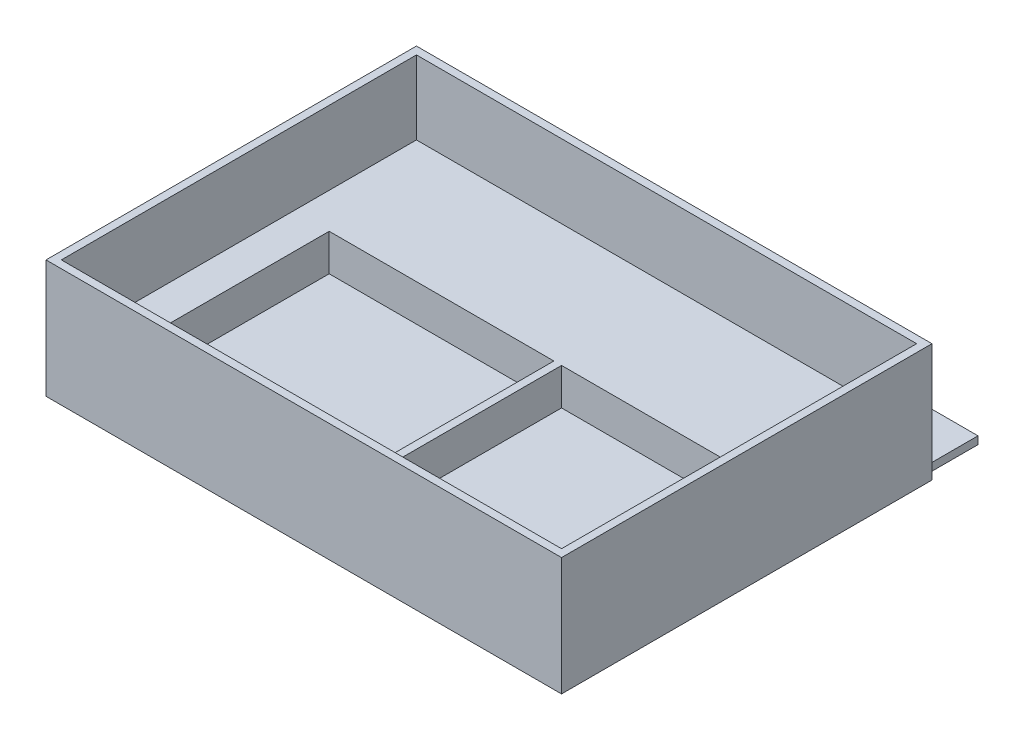
from build123d import *

# Parameters (mm, degrees)
SKETCH1_W            = 609.6
SKETCH1_H            = 304.8
SKETCH1_W_2          = 93
SKETCH1_H_2          = 93
BOSS_EXTRUDE1_DEPTH  = 15.24
SKETCH2_W            = 609.6
SKETCH2_H            = 304.8
BOSS_EXTRUDE2_DEPTH  = 3.175
SKETCH3_W            = 609.6
SKETCH3_H            = 304.8
SKETCH3_W_2          = 603.25
SKETCH3_H_2          = 254
BOSS_EXTRUDE3_DEPTH  = 30.48
SKETCH4_OUTSIDE_W    = 748.262
SKETCH4_OUTSIDE_H    = 443.462
SKETCH4_OUTSIDE_W_2  = 609.6
SKETCH4_OUTSIDE_H_2  = 260.35
CUT_EXTRUDE1_DEPTH   = 45.72
SKETCH5_R            = 3.4925
CUT_EXTRUDE2_DEPTH   = 344.830071983
SKETCH6_W            = 327.140785269
SKETCH6_H            = 256.091806272
TEMPORARY_CUT_DEPTH  = 430.914472374
SKETCH7_W            = 260.35
SKETCH7_H            = 48.895
TEMPORARY_SIDE_DEPTH = 3.175
SKETCH8_W            = 381.398207811
SKETCH8_H            = 265.653299783
CUT_EXTRUDE3_DEPTH   = 354.138073599
SKETCH9_W            = 213.3875
SKETCH9_H            = 48.895
BOSS_EXTRUDE4_DEPTH  = 3.175


with BuildPart() as part:
    # Sketch1 → Boss-Extrude1 (new body)
    with BuildSketch(Plane(origin=(0, 0, 0), x_dir=(1, 0, 0), z_dir=(0, 1, 0))):
        Rectangle(SKETCH1_W, SKETCH1_H)
        with Locations((-48.0875, 29.7)):
            Rectangle(SKETCH1_W_2, SKETCH1_H_2, mode=Mode.SUBTRACT)
        with Locations((-144.2625, 29.7)):
            Rectangle(SKETCH1_W_2, SKETCH1_H_2, mode=Mode.SUBTRACT)
        with Locations((-144.2625, -66.475)):
            Rectangle(SKETCH1_W_2, SKETCH1_H_2, mode=Mode.SUBTRACT)
        with Locations((-48.0875, -66.475)):
            Rectangle(SKETCH1_W_2, SKETCH1_H_2, mode=Mode.SUBTRACT)
        with Locations((-240.4375, 29.7)):
            Rectangle(SKETCH1_W_2, SKETCH1_H_2, mode=Mode.SUBTRACT)
        with Locations((-240.4375, -66.475)):
            Rectangle(SKETCH1_W_2, SKETCH1_H_2, mode=Mode.SUBTRACT)
        with Locations((48.0875, 29.7)):
            Rectangle(SKETCH1_W_2, SKETCH1_H_2, mode=Mode.SUBTRACT)
        with Locations((48.0875, -66.475)):
            Rectangle(SKETCH1_W_2, SKETCH1_H_2, mode=Mode.SUBTRACT)
        with Locations((144.2625, 29.7)):
            Rectangle(SKETCH1_W_2, SKETCH1_H_2, mode=Mode.SUBTRACT)
        with Locations((144.2625, -66.475)):
            Rectangle(SKETCH1_W_2, SKETCH1_H_2, mode=Mode.SUBTRACT)
        with Locations((240.4375, 29.7)):
            Rectangle(SKETCH1_W_2, SKETCH1_H_2, mode=Mode.SUBTRACT)
        with Locations((240.4375, -66.475)):
            Rectangle(SKETCH1_W_2, SKETCH1_H_2, mode=Mode.SUBTRACT)
    extrude(amount=BOSS_EXTRUDE1_DEPTH)

    # Sketch2 → Boss-Extrude2 (add)
    with BuildSketch(Plane(origin=(0, 0, 0), x_dir=(-1, 0, 0), z_dir=(0, -1, 0))):
        Rectangle(SKETCH2_W, SKETCH2_H)
    extrude(amount=BOSS_EXTRUDE2_DEPTH)

    # Sketch3 → Boss-Extrude3 (add)
    with BuildSketch(Plane(origin=(0, 15.24, 0), x_dir=(1, 0, 0), z_dir=(0, 1, 0))):
        Rectangle(SKETCH3_W, SKETCH3_H)
        Rectangle(SKETCH3_W_2, SKETCH3_H_2, mode=Mode.SUBTRACT)
    extrude(amount=BOSS_EXTRUDE3_DEPTH)

    # Sketch4 outside → Cut-Extrude1 (cut)
    with BuildSketch(Plane(origin=(0, 45.72, 0), x_dir=(1, 0, 0), z_dir=(0, 1, 0))):
        Rectangle(SKETCH4_OUTSIDE_W, SKETCH4_OUTSIDE_H)
        Rectangle(SKETCH4_OUTSIDE_W_2, SKETCH4_OUTSIDE_H_2, mode=Mode.SUBTRACT)
    extrude(amount=-CUT_EXTRUDE1_DEPTH, mode=Mode.SUBTRACT)

    # Sketch5 → Cut-Extrude2 (cut, through all)
    with BuildSketch(Plane(origin=(0, 0, 0), x_dir=(1, 0, 0), z_dir=(0, 1, 0))):
        with Locations(Location((-292.1, -139.7, 0), (0, 0, 270))):
            Circle(SKETCH5_R)
        with Locations(Location((-266.7, -139.7, 0), (0, 0, 270))):
            Circle(SKETCH5_R)
        with Locations(Location((-241.3, -139.7, 0), (0, 0, 270))):
            Circle(SKETCH5_R)
        with Locations(Location((-215.9, -139.7, 0), (0, 0, 270))):
            Circle(SKETCH5_R)
        with Locations(Location((-190.5, -139.7, 0), (0, 0, 270))):
            Circle(SKETCH5_R)
        with Locations(Location((-165.1, -139.7, 0), (0, 0, 270))):
            Circle(SKETCH5_R)
        with Locations(Location((-139.7, -139.7, 0), (0, 0, 270))):
            Circle(SKETCH5_R)
        with Locations(Location((-114.3, -139.7, 0), (0, 0, 270))):
            Circle(SKETCH5_R)
        with Locations(Location((-88.9, -139.7, 0), (0, 0, 270))):
            Circle(SKETCH5_R)
        with Locations(Location((-63.5, -139.7, 0), (0, 0, 270))):
            Circle(SKETCH5_R)
        with Locations(Location((-38.1, -139.7, 0), (0, 0, 270))):
            Circle(SKETCH5_R)
        with Locations(Location((-12.7, -139.7, 0), (0, 0, 270))):
            Circle(SKETCH5_R)
        with Locations(Location((12.7, 139.7, 0), (0, 0, 270))):
            Circle(SKETCH5_R)
        with Locations(Location((38.1, 139.7, 0), (0, 0, 270))):
            Circle(SKETCH5_R)
        with Locations(Location((63.5, 139.7, 0), (0, 0, 270))):
            Circle(SKETCH5_R)
        with Locations(Location((88.9, 139.7, 0), (0, 0, 270))):
            Circle(SKETCH5_R)
        with Locations(Location((114.3, 139.7, 0), (0, 0, 270))):
            Circle(SKETCH5_R)
        with Locations(Location((139.7, 139.7, 0), (0, 0, 270))):
            Circle(SKETCH5_R)
        with Locations(Location((165.1, 139.7, 0), (0, 0, 270))):
            Circle(SKETCH5_R)
        with Locations(Location((190.5, 139.7, 0), (0, 0, 270))):
            Circle(SKETCH5_R)
        with Locations(Location((215.9, 139.7, 0), (0, 0, 270))):
            Circle(SKETCH5_R)
        with Locations(Location((241.3, 139.7, 0), (0, 0, 270))):
            Circle(SKETCH5_R)
        with Locations(Location((-292.1, 139.7, 0), (0, 0, 270))):
            Circle(SKETCH5_R)
        with Locations(Location((-266.7, 139.7, 0), (0, 0, 270))):
            Circle(SKETCH5_R)
        with Locations(Location((-241.3, 139.7, 0), (0, 0, 270))):
            Circle(SKETCH5_R)
        with Locations(Location((-215.9, 139.7, 0), (0, 0, 270))):
            Circle(SKETCH5_R)
        with Locations(Location((-190.5, 139.7, 0), (0, 0, 270))):
            Circle(SKETCH5_R)
        with Locations(Location((-165.1, 139.7, 0), (0, 0, 270))):
            Circle(SKETCH5_R)
        with Locations(Location((-139.7, 139.7, 0), (0, 0, 270))):
            Circle(SKETCH5_R)
        with Locations(Location((-114.3, 139.7, 0), (0, 0, 270))):
            Circle(SKETCH5_R)
        with Locations(Location((-88.9, 139.7, 0), (0, 0, 270))):
            Circle(SKETCH5_R)
        with Locations(Location((-63.5, 139.7, 0), (0, 0, 270))):
            Circle(SKETCH5_R)
        with Locations(Location((-38.1, 139.7, 0), (0, 0, 270))):
            Circle(SKETCH5_R)
        with Locations(Location((-12.7, 139.7, 0), (0, 0, 270))):
            Circle(SKETCH5_R)
        with Locations(Location((266.7, 139.7, 0), (0, 0, 270))):
            Circle(SKETCH5_R)
        with Locations(Location((292.1, 139.7, 0), (0, 0, 270))):
            Circle(SKETCH5_R)
        with Locations(Location((12.7, -139.7, 0), (0, 0, 270))):
            Circle(SKETCH5_R)
        with Locations(Location((38.1, -139.7, 0), (0, 0, 270))):
            Circle(SKETCH5_R)
        with Locations(Location((63.5, -139.7, 0), (0, 0, 270))):
            Circle(SKETCH5_R)
        with Locations(Location((88.9, -139.7, 0), (0, 0, 270))):
            Circle(SKETCH5_R)
        with Locations(Location((114.3, -139.7, 0), (0, 0, 270))):
            Circle(SKETCH5_R)
        with Locations(Location((139.7, -139.7, 0), (0, 0, 270))):
            Circle(SKETCH5_R)
        with Locations(Location((165.1, -139.7, 0), (0, 0, 270))):
            Circle(SKETCH5_R)
        with Locations(Location((190.5, -139.7, 0), (0, 0, 270))):
            Circle(SKETCH5_R)
        with Locations(Location((215.9, -139.7, 0), (0, 0, 270))):
            Circle(SKETCH5_R)
        with Locations(Location((241.3, -139.7, 0), (0, 0, 270))):
            Circle(SKETCH5_R)
        with Locations(Location((266.7, -139.7, 0), (0, 0, 270))):
            Circle(SKETCH5_R)
        with Locations(Location((292.1, -139.7, 0), (0, 0, 270))):
            Circle(SKETCH5_R)
    extrude(amount=-CUT_EXTRUDE2_DEPTH, mode=Mode.SUBTRACT)

    # Sketch6 → Temporary_Cut (cut, through all)
    with BuildSketch(Plane(origin=(-94.5875, 0, 0), x_dir=(0, 0, -1), z_dir=(1, 0, 0))):
        with Locations((-7.828616148, 44.910513642)):
            Rectangle(SKETCH6_W, SKETCH6_H)
    extrude(amount=TEMPORARY_CUT_DEPTH, mode=Mode.SUBTRACT)

    # Sketch7 → Temporary_Side (add)
    with BuildSketch(Plane(origin=(-94.5875, 0, 0), x_dir=(0, 0, -1), z_dir=(1, 0, 0))):
        with Locations((0, 21.2725)):
            Rectangle(SKETCH7_W, SKETCH7_H)
    extrude(amount=TEMPORARY_SIDE_DEPTH)

    # Sketch8 → Cut-Extrude3 (cut, through all)
    with BuildSketch(Plane.XY.offset(19.975)):
        with Locations((-174.977799194, 15.778240494)):
            Rectangle(SKETCH8_W, SKETCH8_H)
    extrude(amount=CUT_EXTRUDE3_DEPTH, mode=Mode.SUBTRACT)

    # Sketch9 → Boss-Extrude4 (add)
    with BuildSketch(Plane.XY.offset(19.975)):
        with Locations((-198.10625, 21.2725)):
            Rectangle(SKETCH9_W, SKETCH9_H)
    extrude(amount=BOSS_EXTRUDE4_DEPTH)


solid = part.part
